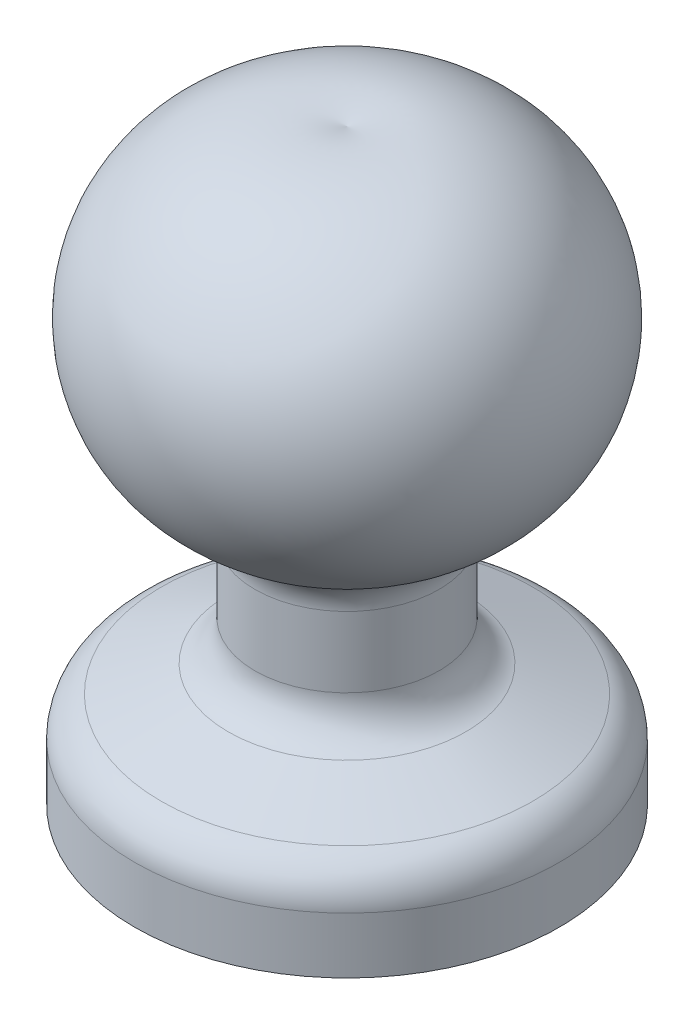
from build123d import *


with BuildPart() as part:
    # Sketch1 → Revolve3 (revolve)
    with BuildSketch(Plane.XY, mode=Mode.PRIVATE) as revolve3_sk:
        with BuildLine():
            Line((0, -68.022293588), (25, -68.022293588))
            Line((25, -68.022293588), (25, -61.411081925))
            ThreePointArc((25, -61.411081925), (24.138943151, -58.605881469), (21.852340162, -56.76685584))
            Line((21.852340162, -56.76685584), (13.977616179, -53.626038138))
            ThreePointArc((13.977616179, -53.626038138), (11.69101319, -51.787012509), (10.829956341, -48.981812053))
            Line((10.829956341, -48.981812053), (10.829956341, -40.687972187))
            ThreePointArc((10.829956341, -40.687972187), (11.569257357, -38.071401117), (13.568534007, -36.228603507))
            ThreePointArc((13.568534007, -36.228603507), (23.319059693, -11.557220625), (0, 1.090757059))
            Line((0, 1.090757059), (0, -68.022293588))
        make_face()
    revolve(revolve3_sk.sketch.rotate(Axis((0, 86.052299117, 0), (0, -1, 0)), 90), axis=Axis((0, 86.052299117, 0), (0, -1, 0)))


solid = part.part
